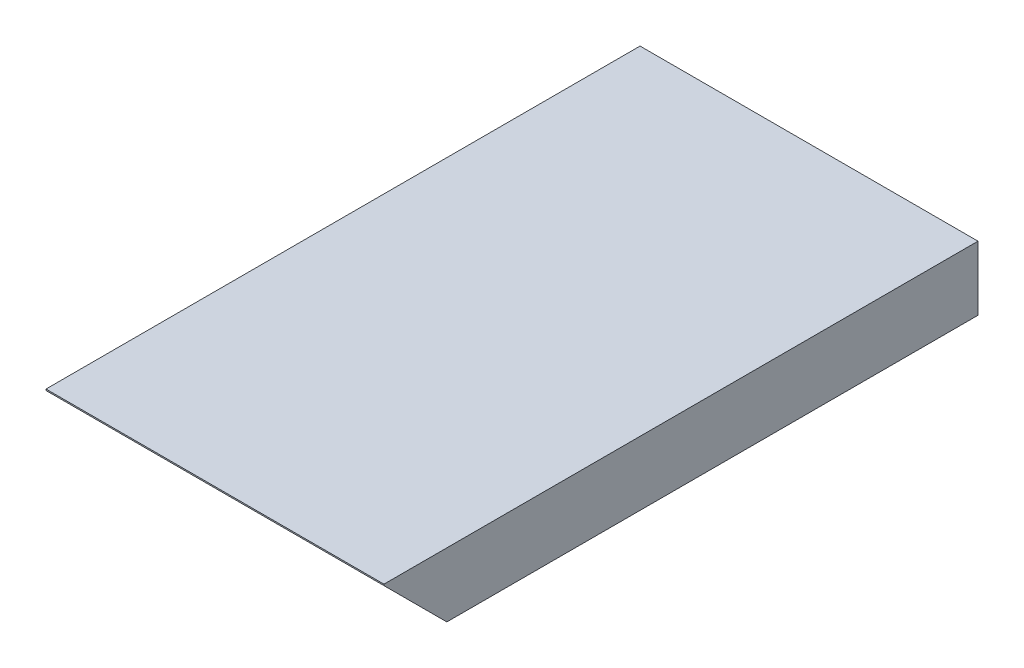
from build123d import *

# Parameters (mm, degrees)
ESQUISSE1_W      = 25.8
ESQUISSE1_H      = 45.349242405
EXTRUSION1_DEPTH = 4.9
CHANFREIN2_SIZE  = 4.8


with BuildPart() as part:
    # Esquisse1 → Extrusion1 (new body)
    with BuildSketch(Plane(origin=(0, 0, 0), x_dir=(1, 0, 0), z_dir=(0, 1, 0))):
        with Locations((0, 1.325378797)):
            Rectangle(ESQUISSE1_W, ESQUISSE1_H)
    extrude(amount=EXTRUSION1_DEPTH)

    # Chanfrein2
    chanfrein2_edges = [part.edges().sort_by_distance(p)[0] for p in [
        (0, 0, 21.349242405),
    ]]
    chamfer(chanfrein2_edges, length=CHANFREIN2_SIZE)


solid = part.part
